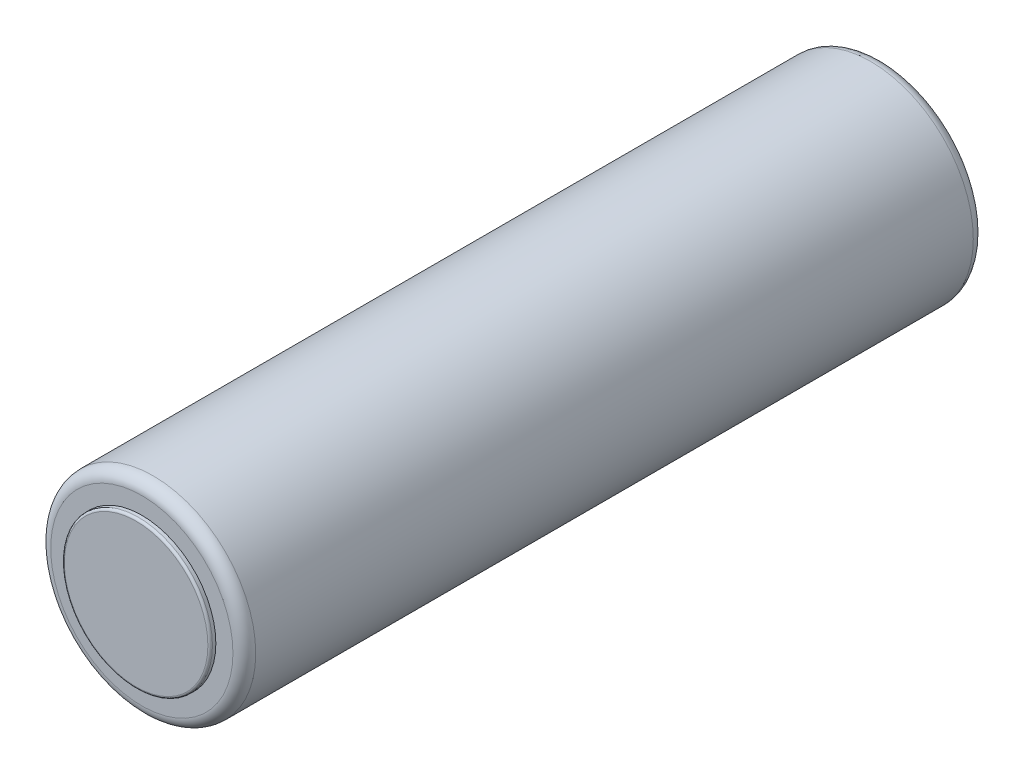
from build123d import *

# Parameters (mm, degrees)
SKETCH_1_R      = 9
EXTRUDE_1_DEPTH = 65
FILLET_1_R      = 1
SKETCH_2_R      = 2.5
EXTRUDE_2_DEPTH = 1
SKETCH_3_R      = 6.5
EXTRUDE_3_DEPTH = 0.5
FILLET_2_R      = 0.2
FILLET_3_R      = 0.2


with BuildPart() as part:
    # Эскиз1 → Бобышка-Вытянуть1 (new body)
    with BuildSketch(Plane.XY):
        Circle(SKETCH_1_R)
    extrude(amount=EXTRUDE_1_DEPTH)

    # Скругление1
    fillet_1_edges = [part.edges().sort_by_distance(p)[0] for p in [
        (-9, 0, 0),
        (-9, 0, 65),
    ]]
    fillet(fillet_1_edges, radius=FILLET_1_R)


with BuildPart() as body_2:
    # Эскиз2 → Бобышка-Вытянуть2 (new body)
    with BuildSketch(Plane(origin=(0, 0, 0), x_dir=(-1, 0, 0), z_dir=(0, 0, -1))):
        Circle(SKETCH_2_R)
    extrude(amount=EXTRUDE_2_DEPTH)

    # Скругление2
    fillet_2_edges = [body_2.edges().sort_by_distance(p)[0] for p in [
        (2.5, 0, -1),
    ]]
    fillet(fillet_2_edges, radius=FILLET_2_R)


with BuildPart() as body_3:
    # Эскиз3 → Бобышка-Вытянуть3 (new body)
    with BuildSketch(Plane.XY.offset(65)):
        Circle(SKETCH_3_R)
    extrude(amount=EXTRUDE_3_DEPTH)

    # Скругление3
    fillet_3_edges = [body_3.edges().sort_by_distance(p)[0] for p in [
        (-6.5, 0, 65.5),
    ]]
    fillet(fillet_3_edges, radius=FILLET_3_R)


solid = Compound([part.part, body_2.part, body_3.part])
